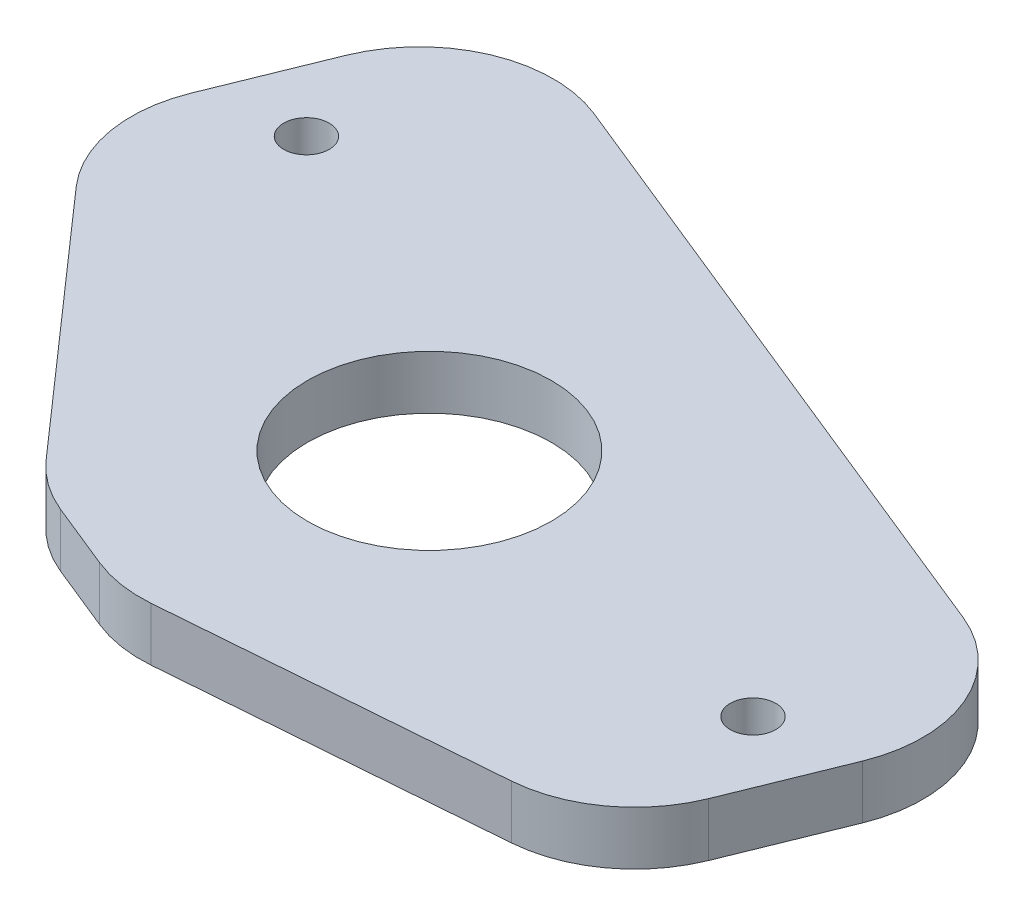
from build123d import *

# Parameters (mm, degrees)
SKETCH_1_R          = 1.7
SKETCH_1_R_2        = 9.1
EXTRUDE_1_DEPTH     = 4
CUT_EXTRUDE_1_DEPTH = 4
FILLET_1_R          = 10


with BuildPart() as part:
    # 草图1 → 凸台-拉伸1 (new body)
    with BuildSketch(Plane(origin=(0, 0, 0), x_dir=(1, 0, 0), z_dir=(0, 1, 0))):
        Polygon((-126.240398859, 38.128502465), (-191.110616974, 64.43163539), (-206.140978645, 27.362939325), (-141.27076053, 1.059806399), align=None)
        with Locations(Location((-136.961696425, 27.654734478, 0), (0, 0, 270))):
            Circle(SKETCH_1_R, mode=Mode.SUBTRACT)
        with Locations(Location((-191.102800779, 48.48323248, 0), (0, 0, 270))):
            Circle(SKETCH_1_R, mode=Mode.SUBTRACT)
        with Locations(Location((-166.190688752, 32.745720895, 0), (0, 0, 270))):
            Circle(SKETCH_1_R_2, mode=Mode.SUBTRACT)
    extrude(amount=EXTRUDE_1_DEPTH)

    # 草图2 → 切除-拉伸1 (cut)
    with BuildSketch(Plane(origin=(0, 4, 0), x_dir=(1, 0, 0), z_dir=(0, 1, 0))):
        Polygon((-135.634374903, 14.960567424), (-169.07228258, 12.332577653), (-141.27076053, 1.059806399), align=None)
        Polygon((-200.504593019, 41.263700349), (-178.339456596, 16.090168071), (-206.140978645, 27.362939325), align=None)
    extrude(amount=-CUT_EXTRUDE_1_DEPTH, mode=Mode.SUBTRACT)

    # 圆角1
    fillet_1_edges = [part.edges().sort_by_distance(p)[0] for p in [
        (-135.634374903, 2, -14.960567424),
        (-169.07228258, 2, -12.332577653),
        (-200.504593019, 2, -41.263700349),
        (-178.339456596, 2, -16.090168071),
        (-191.110616974, 2, -64.43163539),
        (-126.240398859, 2, -38.128502465),
    ]]
    fillet(fillet_1_edges, radius=FILLET_1_R)


solid = part.part
